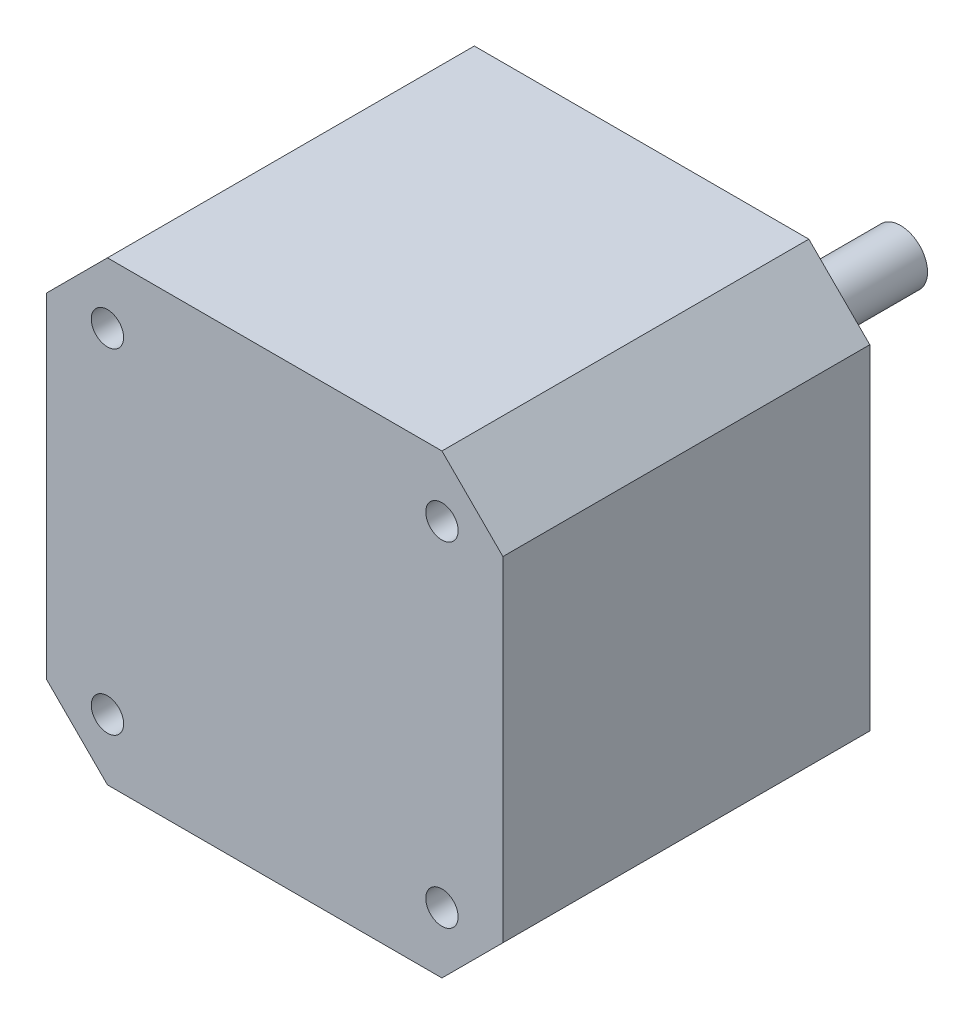
from build123d import *

# Parameters (mm, degrees)
SKETCH1_R           = 1.5
BOSS_EXTRUDE1_DEPTH = 34


with BuildPart() as part:
    # Sketch1 → Boss-Extrude1 (new body)
    with BuildSketch(Plane.XY):
        Polygon((-15.5, 21.15), (-21.15, 15.5), (-21.15, -15.5), (-15.5, -21.15), (15.5, -21.15), (21.15, -15.5), (21.15, 15.5), (15.5, 21.15), align=None)
        with Locations((15.5, 15.5)):
            Circle(SKETCH1_R, mode=Mode.SUBTRACT)
        with Locations((15.5, -15.5)):
            Circle(SKETCH1_R, mode=Mode.SUBTRACT)
        with Locations((-15.5, -15.5)):
            Circle(SKETCH1_R, mode=Mode.SUBTRACT)
        with Locations((-15.5, 15.5)):
            Circle(SKETCH1_R, mode=Mode.SUBTRACT)
    extrude(amount=BOSS_EXTRUDE1_DEPTH)

    # Sketch3 → Revolve1 (revolve)
    with BuildSketch(Plane(origin=(0, 0, 0), x_dir=(0, 0, -1), z_dir=(1, 0, 0)), mode=Mode.PRIVATE) as revolve1_sk:
        Polygon((0, 0), (24, 0), (24, 2.5), (2, 2.5), (2, 11), (0, 11), align=None)
    revolve(revolve1_sk.sketch.rotate(Axis((0, 0, 0), (0, 0, -1)), 90), axis=Axis((0, 0, 0), (0, 0, -1)))


solid = part.part
